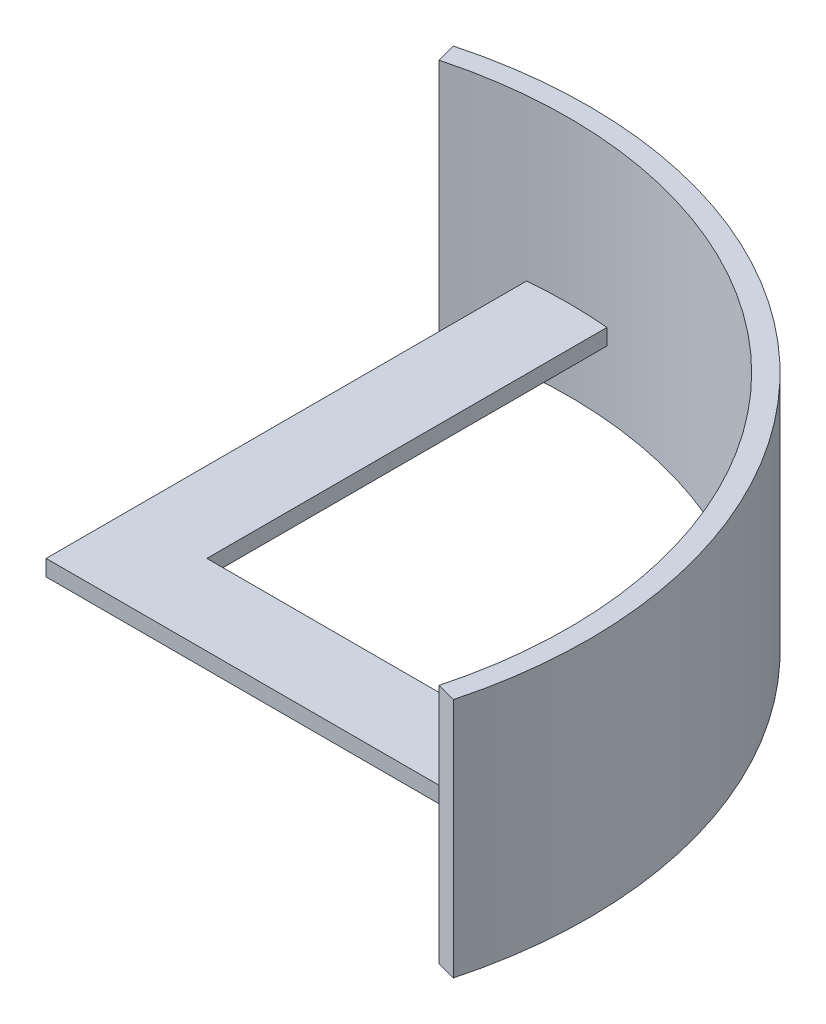
from build123d import *

# Parameters (mm, degrees)
BOSS_EXTRUDE1_DEPTH      = 2.54
BOSS_EXTRUDE4_DEPTH      = 25.4
BOSS_EXTRUDE4_DEPTH_BACK = 12.7


with BuildPart() as part:
    # Sketch1 → Boss-Extrude1 (new body)
    with BuildSketch(Plane(origin=(0, 0, 0), x_dir=(1, 0, 0), z_dir=(0, 1, 0))):
        Polygon((-6.35, 69.85), (-6.35, -6.35), (69.85, -6.35), (69.85, 6.35), (6.35, 6.35), (6.35, 69.85), align=None)
    extrude(amount=BOSS_EXTRUDE1_DEPTH)

    # Sketch2 → Boss-Extrude4 (add, two sides: drawn at the far end of the back side and taken through both)
    with BuildSketch(Plane(origin=(0, 2.54, 0), x_dir=(1, 0, 0), z_dir=(0, 1, 0)).offset(-BOSS_EXTRUDE4_DEPTH_BACK)):
        with BuildLine():
            Line((-18.900260769, 70.536733465), (-18.0785103, 67.469918966))
            ThreePointArc((-18.0785103, 67.469918966), (49.391408666, 49.391408666), (67.469918966, -18.0785103))
            Line((67.469918966, -18.0785103), (70.536733465, -18.900260769))
            ThreePointArc((70.536733465, -18.900260769), (51.636472696, 51.636472696), (-18.900260769, 70.536733465))
        make_face()
    extrude(amount=BOSS_EXTRUDE4_DEPTH + BOSS_EXTRUDE4_DEPTH_BACK)


solid = part.part
